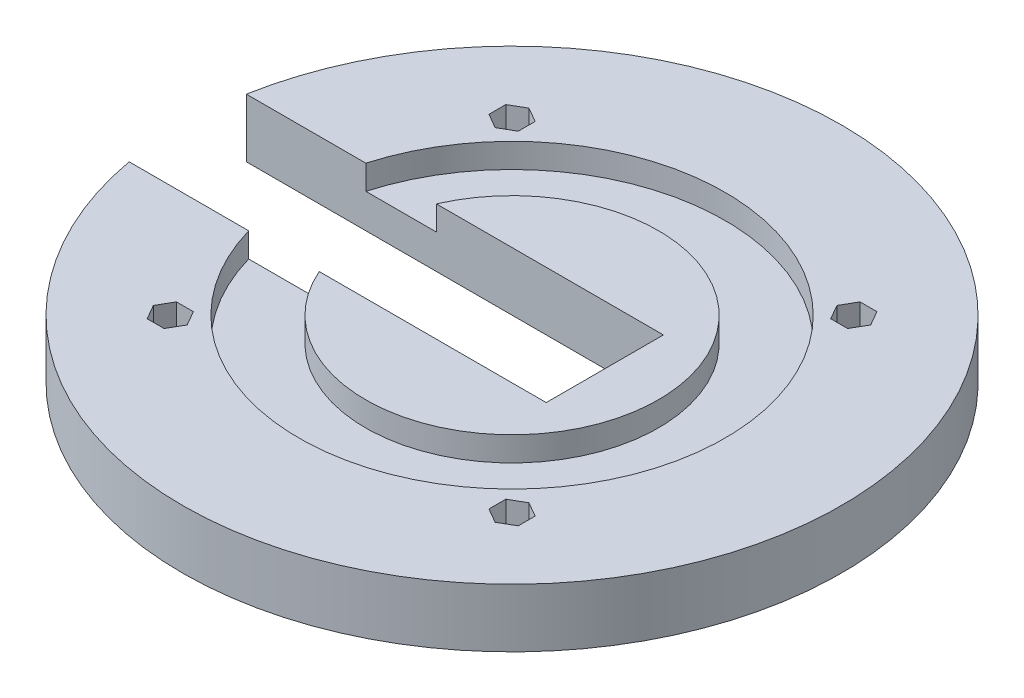
from build123d import *

# Parameters (mm, degrees)
SKETCH_1_R          = 67.5
EXTRUDE_1_DEPTH     = 12
SKETCH_2_W          = 60
SKETCH_2_H          = 24
CUT_EXTRUDE_1_DEPTH = 97.210706265
CUT_EXTRUDE_3_DEPTH = 97.210706265
SKETCH_5_R          = 43.625
SKETCH_5_R_2        = 30
CUT_EXTRUDE_4_DEPTH = 5
SKETCH_6_W          = 75.06754016
SKETCH_6_H          = 24
CUT_EXTRUDE_5_DEPTH = 97.210706265


with BuildPart() as part:
    # 草图1 → 凸台-拉伸1 (new body)
    with BuildSketch(Plane(origin=(0, 0, 0), x_dir=(1, 0, 0), z_dir=(0, 1, 0))):
        with Locations(Location((0, 0, 0), (0, 0, 270))):
            Circle(SKETCH_1_R)
    extrude(amount=EXTRUDE_1_DEPTH)

    # 草图2 → 切除-拉伸1 (cut, through all)
    with BuildSketch(Plane(origin=(0, 12, 0), x_dir=(1, 0, 0), z_dir=(0, 1, 0))):
        with Locations((-11, 0)):
            Rectangle(SKETCH_2_W, SKETCH_2_H)
    extrude(amount=-CUT_EXTRUDE_1_DEPTH, mode=Mode.SUBTRACT)

    # 草图4 → 切除-拉伸3 (cut, through all)
    with BuildSketch(Plane(origin=(0, 12, 0), x_dir=(1, 0, 0), z_dir=(0, 1, 0))):
        Polygon((35.001785669, -38.465887284), (38.001785669, -36.733836476), (38.001785669, -33.269734861), (35.001785669, -31.537684054), (32.001785669, -33.269734861), (32.001785669, -36.733836476), align=None)
        Polygon((38.465887284, 35.001785669), (36.733836476, 38.001785669), (33.269734861, 38.001785669), (31.537684054, 35.001785669), (33.269734861, 32.001785669), (36.733836476, 32.001785669), align=None)
        Polygon((-38.465887284, -35.001785669), (-36.733836476, -38.001785669), (-33.269734861, -38.001785669), (-31.537684054, -35.001785669), (-33.269734861, -32.001785669), (-36.733836476, -32.001785669), align=None)
        Polygon((-35.001785669, 38.465887284), (-38.001785669, 36.733836476), (-38.001785669, 33.269734861), (-35.001785669, 31.537684054), (-32.001785669, 33.269734861), (-32.001785669, 36.733836476), align=None)
    extrude(amount=-CUT_EXTRUDE_3_DEPTH, mode=Mode.SUBTRACT)

    # 草图5 → 切除-拉伸4 (cut)
    with BuildSketch(Plane(origin=(0, 12, 0), x_dir=(1, 0, 0), z_dir=(0, 1, 0))):
        with Locations(Location((0, 0, 0), (0, 0, 270))):
            Circle(SKETCH_5_R)
        Circle(SKETCH_5_R_2, mode=Mode.SUBTRACT)
    extrude(amount=-CUT_EXTRUDE_4_DEPTH, mode=Mode.SUBTRACT)

    # 草图6 → 切除-拉伸5 (cut, through all)
    with BuildSketch(Plane(origin=(0, 12, 0), x_dir=(1, 0, 0), z_dir=(0, 1, 0))):
        with Locations((-78.53377008, 0)):
            Rectangle(SKETCH_6_W, SKETCH_6_H)
    extrude(amount=-CUT_EXTRUDE_5_DEPTH, mode=Mode.SUBTRACT)


solid = part.part
